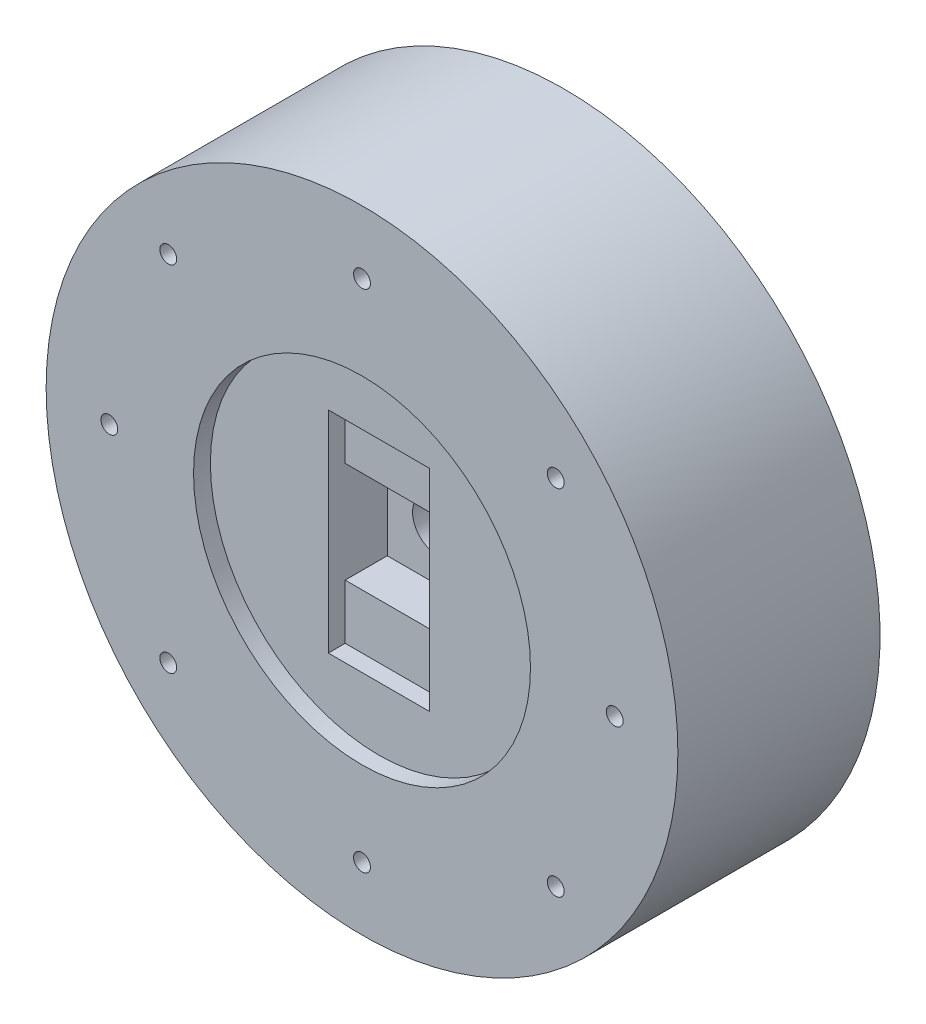
from build123d import *

# Parameters (mm, degrees)
SKETCH_1_R      = 37.5
SKETCH_1_R_2    = 3
EXTRUDE_1_DEPTH = 5
EXTRUDE_START   = 10
SKETCH_2_R      = 37.5
EXTRUDE_2_DEPTH = 10
SKETCH_3_R      = 37.5
SKETCH_3_R_2    = 1
SKETCH_3_W      = 12
SKETCH_3_H      = 12
EXTRUDE_3_DEPTH = 5
SKETCH_4_R      = 37.5
SKETCH_4_R_2    = 1
SKETCH_4_W      = 12
SKETCH_4_H      = 25
EXTRUDE_4_DEPTH = 2
SKETCH_5_R      = 37.5
SKETCH_5_R_2    = 20
SKETCH_5_R_3    = 1
EXTRUDE_5_DEPTH = 2


with BuildPart() as part:
    # Эскиз1 → Бобышка-Вытянуть1 (new body)
    with BuildSketch(Plane.XY):
        Circle(SKETCH_1_R)
        Circle(SKETCH_1_R_2, mode=Mode.SUBTRACT)
    extrude(amount=EXTRUDE_1_DEPTH)

    # Эскиз2 → Бобышка-Вытянуть2 (add)
    with BuildSketch(Plane(origin=(0, 0, 0), x_dir=(-1, 0, 0), z_dir=(0, 0, -1)).offset(EXTRUDE_START)):
        Circle(SKETCH_2_R)
    extrude(amount=-EXTRUDE_2_DEPTH)

    # Эскиз3 → Бобышка-Вытянуть3 (add)
    with BuildSketch(Plane.XY.offset(5)):
        with Locations(Location((0, 0, 0), (0, 0, 180))):
            Circle(SKETCH_3_R)
        with Locations((0, 30)):
            Circle(SKETCH_3_R_2, mode=Mode.SUBTRACT)
        with Locations((0, -30)):
            Circle(SKETCH_3_R_2, mode=Mode.SUBTRACT)
        with Locations((-30, 0)):
            Circle(SKETCH_3_R_2, mode=Mode.SUBTRACT)
        with Locations((30, 0)):
            Circle(SKETCH_3_R_2, mode=Mode.SUBTRACT)
        with Locations((-23, 21)):
            Circle(SKETCH_3_R_2, mode=Mode.SUBTRACT)
        with Locations((-23, -21)):
            Circle(SKETCH_3_R_2, mode=Mode.SUBTRACT)
        with Locations((23, -21)):
            Circle(SKETCH_3_R_2, mode=Mode.SUBTRACT)
        with Locations((23, 21)):
            Circle(SKETCH_3_R_2, mode=Mode.SUBTRACT)
        Rectangle(SKETCH_3_W, SKETCH_3_H, mode=Mode.SUBTRACT)
    extrude(amount=EXTRUDE_3_DEPTH)

    # Эскиз4 → Бобышка-Вытянуть4 (add)
    with BuildSketch(Plane.XY.offset(10)):
        with Locations(Location((0, 0, 0), (0, 0, 180))):
            Circle(SKETCH_4_R)
        with Locations((0, 30)):
            Circle(SKETCH_4_R_2, mode=Mode.SUBTRACT)
        with Locations((0, -30)):
            Circle(SKETCH_4_R_2, mode=Mode.SUBTRACT)
        with Locations((-30, 0)):
            Circle(SKETCH_4_R_2, mode=Mode.SUBTRACT)
        with Locations((30, 0)):
            Circle(SKETCH_4_R_2, mode=Mode.SUBTRACT)
        with Locations((-23, -21)):
            Circle(SKETCH_4_R_2, mode=Mode.SUBTRACT)
        with Locations((23, -21)):
            Circle(SKETCH_4_R_2, mode=Mode.SUBTRACT)
        with Locations((-23, 21)):
            Circle(SKETCH_4_R_2, mode=Mode.SUBTRACT)
        with Locations((23, 21)):
            Circle(SKETCH_4_R_2, mode=Mode.SUBTRACT)
        Rectangle(SKETCH_4_W, SKETCH_4_H, mode=Mode.SUBTRACT)
    extrude(amount=EXTRUDE_4_DEPTH)

    # Эскиз5 → Бобышка-Вытянуть5 (add)
    with BuildSketch(Plane.XY.offset(12)):
        with Locations(Location((0, 0, 0), (0, 0, 180))):
            Circle(SKETCH_5_R)
        Circle(SKETCH_5_R_2, mode=Mode.SUBTRACT)
        with Locations((0, 30)):
            Circle(SKETCH_5_R_3, mode=Mode.SUBTRACT)
        with Locations((0, -30)):
            Circle(SKETCH_5_R_3, mode=Mode.SUBTRACT)
        with Locations((-30, 0)):
            Circle(SKETCH_5_R_3, mode=Mode.SUBTRACT)
        with Locations((30, 0)):
            Circle(SKETCH_5_R_3, mode=Mode.SUBTRACT)
        with Locations((-23, 21)):
            Circle(SKETCH_5_R_3, mode=Mode.SUBTRACT)
        with Locations((23, 21)):
            Circle(SKETCH_5_R_3, mode=Mode.SUBTRACT)
        with Locations((-23, -21)):
            Circle(SKETCH_5_R_3, mode=Mode.SUBTRACT)
        with Locations((23, -21)):
            Circle(SKETCH_5_R_3, mode=Mode.SUBTRACT)
    extrude(amount=EXTRUDE_5_DEPTH)


solid = part.part
